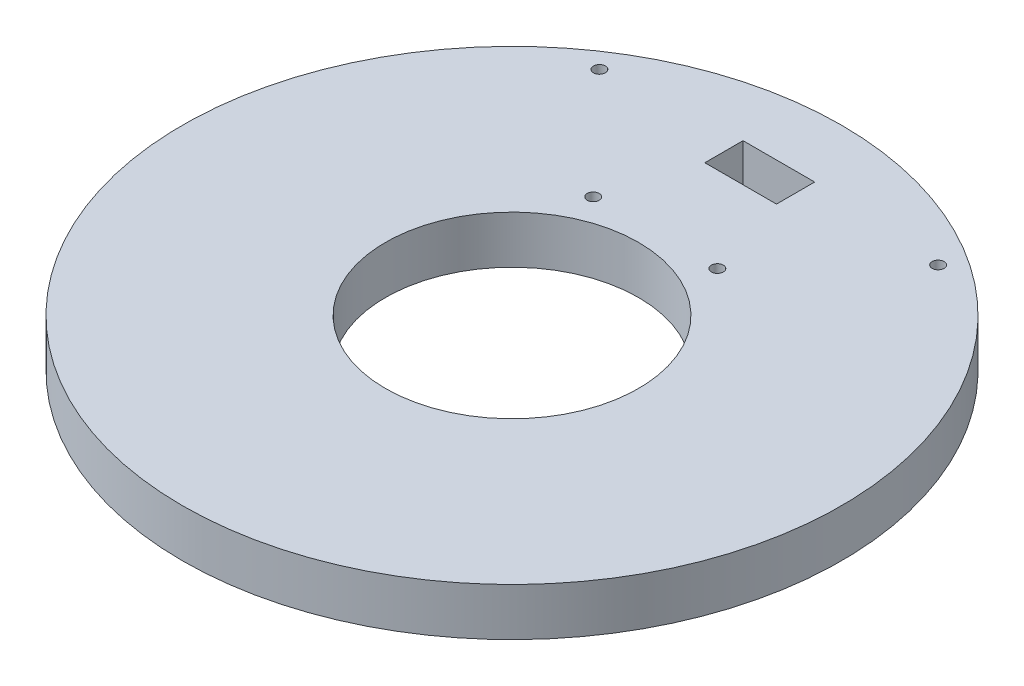
from build123d import *

# Parameters (mm, degrees)
SKETCH1_R           = 69
SKETCH1_R_2         = 26.5
BOSS_EXTRUDE1_DEPTH = 10
CUT_EXTRUDE1_DEPTH  = 4.5
SKETCH3_W           = 15
SKETCH3_H           = 8
CUT_EXTRUDE2_DEPTH  = 99.091793744
SKETCH4_R           = 1.25
CUT_EXTRUDE3_DEPTH  = 99.091793744
SKETCH5_R           = 2.75
CUT_EXTRUDE4_DEPTH  = 8.2


with BuildPart() as part:
    # Sketch1 → Boss-Extrude1 (new body)
    with BuildSketch(Plane(origin=(0, 0, 0), x_dir=(1, 0, 0), z_dir=(0, 1, 0))):
        with Locations(Location((0, 0, 0), (0, 0, 270))):
            Circle(SKETCH1_R)
        with Locations(Location((0, 0, 0), (0, 0, 270))):
            Circle(SKETCH1_R_2, mode=Mode.SUBTRACT)
    extrude(amount=BOSS_EXTRUDE1_DEPTH)

    # Sketch2 → Cut-Extrude1 (cut)
    with BuildSketch(Plane.XZ):
        Polygon((-13, -34.242640687), (-17.242640687, -30), (-13, -25.757359313), (-8.757359313, -30), align=None)
        Polygon((-35.46, -58.000880986), (-39.702640687, -53.758240299), (-35.46, -49.515599611), (-31.217359313, -53.758240299), align=None)
        Polygon((13, -34.242640687), (8.757359313, -30), (13, -25.757359313), (17.242640687, -30), align=None)
        Polygon((35.46, -58.000880986), (31.217359313, -53.758240299), (35.46, -49.515599611), (39.702640687, -53.758240299), align=None)
    extrude(amount=-CUT_EXTRUDE1_DEPTH, mode=Mode.SUBTRACT)

    # Sketch3 → Cut-Extrude2 (cut, through all)
    with BuildSketch(Plane.XZ):
        with Locations((0, -51.875)):
            Rectangle(SKETCH3_W, SKETCH3_H)
    extrude(amount=-CUT_EXTRUDE2_DEPTH, mode=Mode.SUBTRACT)

    # Sketch4 → Cut-Extrude3 (cut, through all)
    with BuildSketch(Plane.XZ):
        with Locations(Location((-13, -30, 0), (0, 0, 270))):
            Circle(SKETCH4_R)
        with Locations(Location((13, -30, 0), (0, 0, 270))):
            Circle(SKETCH4_R)
        with Locations(Location((-35.46, -53.758240299, 0), (0, 0, 270))):
            Circle(SKETCH4_R)
        with Locations(Location((35.46, -53.758240299, 0), (0, 0, 270))):
            Circle(SKETCH4_R)
    extrude(amount=-CUT_EXTRUDE3_DEPTH, mode=Mode.SUBTRACT)

    # Sketch5 → Cut-Extrude4 (cut)
    with BuildSketch(Plane.XZ):
        with Locations(Location((-44.901280605, 44.901280605, 0), (0, 0, 270))):
            Circle(SKETCH5_R)
        with Locations(Location((44.901280605, 44.901280605, 0), (0, 0, 270))):
            Circle(SKETCH5_R)
        with Locations(Location((-43, -46.725260834, 0), (0, 0, 270))):
            Circle(SKETCH5_R)
        with Locations(Location((43, -46.725260834, 0), (0, 0, 270))):
            Circle(SKETCH5_R)
    extrude(amount=-CUT_EXTRUDE4_DEPTH, mode=Mode.SUBTRACT)


solid = part.part
